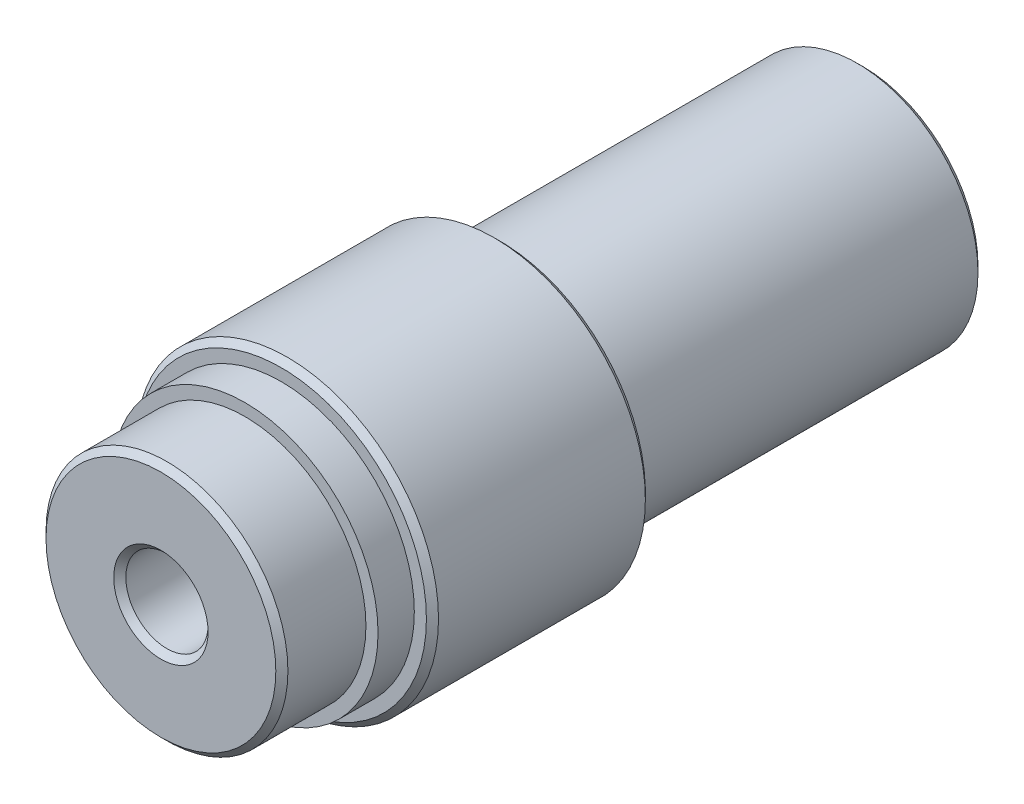
from build123d import *

# Parameters (mm, degrees)
SKETCH1_R                     = 12.5
MIL_CONFIGURED_CAP_25_1_DEPTH = 58.05
IZIM3_W                       = 30
IZIM3_H                       = 2.5
IZIM3_W_2                     = 6.95
PAH1_SIZE                     = 0.5
PAH2_SIZE                     = 1.5
IZIM6_W                       = 3
IZIM6_H                       = 1.5
PAH3_SIZE                     = 0.5


with BuildPart() as part:
    # Sketch1 → Mil - configured CAP=25(1) (new body)
    with BuildSketch(Plane.YX.offset(-29.025)):
        Circle(SKETCH1_R)
    extrude(amount=MIL_CONFIGURED_CAP_25_1_DEPTH)

    # Çizim3 → Kes-Döndür1 (revolve, cut)
    with BuildSketch(Plane(origin=(0, 0, 0), x_dir=(0, 0, -1), z_dir=(1, 0, 0)), mode=Mode.PRIVATE) as kes_d_nd_r1_sk:
        with Locations((14.025, 11.25)):
            Rectangle(IZIM3_W, IZIM3_H)
        with Locations((-25.55, 11.25)):
            Rectangle(IZIM3_W_2, IZIM3_H)
    revolve(kes_d_nd_r1_sk.sketch.rotate(Axis((0, 0, -29.025), (0, 0, -1)), 90), axis=Axis((0, 0, -29.025), (0, 0, -1)), mode=Mode.SUBTRACT)

    # Çizim4 → M8 Dişli Delik1 (revolve, cut)
    with BuildSketch(Plane(origin=(0, 0, 29.025), x_dir=(0, -1, 0), z_dir=(1, 0, 0))):
        Polygon((0, 0), (0, 24.292926105), (3.4, 22.25), (3.4, 0), align=None)
    m8_di_li_delik1 = revolve(axis=Axis((0, 0, 35.375), (0, 0, -1)), mode=Mode.SUBTRACT)

    # Aynalama1: M8 Dişli Delik1 across plane
    add(m8_di_li_delik1.mirror(Plane.XY), mode=Mode.SUBTRACT)

    # Pah1
    pah1_edges = [part.edges().sort_by_distance(p)[0] for p in [
        (-10, 0, 29.025),
        (0, 3.4, 29.025),
        (0, 3.4, -29.025),
        (-10, 0, -29.025),
        (0, -12.5, 0.975),
    ]]
    chamfer(pah1_edges, length=PAH1_SIZE)

    # Pah2
    pah2_edges = [part.edges().sort_by_distance(p)[0] for p in [
        (0, -12.5, 22.075),
    ]]
    chamfer(pah2_edges, length=PAH2_SIZE)

    # Çizim6 → Kes-Döndür2 (revolve, cut)
    with BuildSketch(Plane(origin=(0, 0, 0), x_dir=(0, 0, -1), z_dir=(1, 0, 0)), mode=Mode.PRIVATE) as kes_d_nd_r2_sk:
        with Locations((-20.575, 11.75)):
            Rectangle(IZIM6_W, IZIM6_H)
    revolve(kes_d_nd_r2_sk.sketch.rotate(Axis((0, 0, 29.025), (0, 0, 1)), 180), axis=Axis((0, 0, 29.025), (0, 0, 1)), mode=Mode.SUBTRACT)

    # Pah3
    pah3_edges = [part.edges().sort_by_distance(p)[0] for p in [
        (0, -12.5, 19.075),
    ]]
    chamfer(pah3_edges, length=PAH3_SIZE)


solid = part.part
